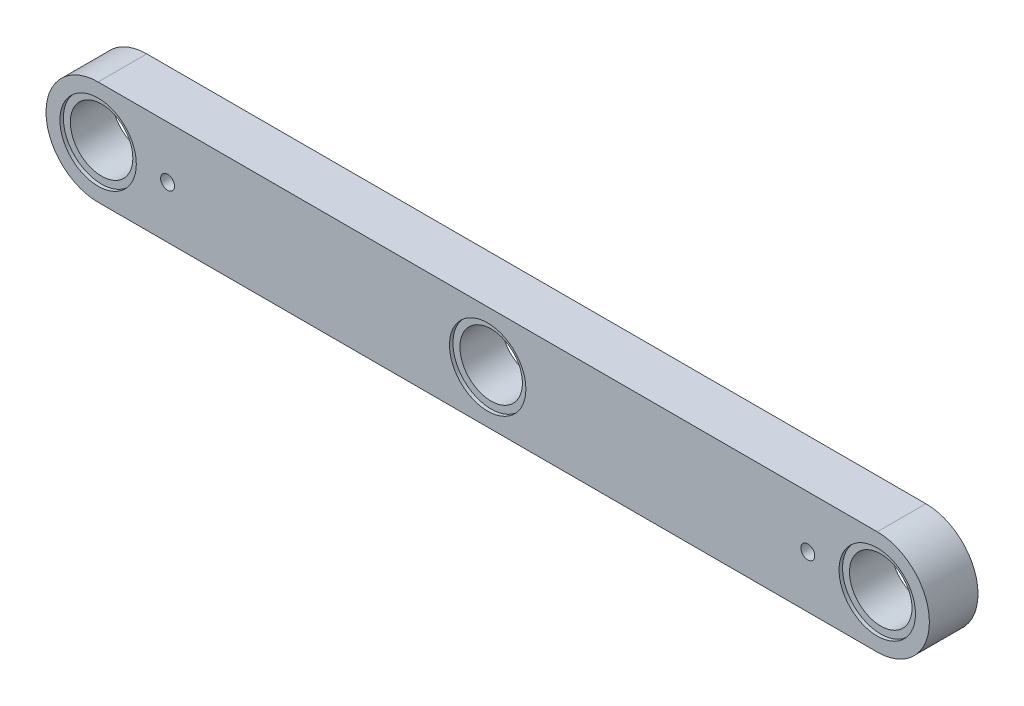
from build123d import *

# Parameters (mm, degrees)
SKETCH1_R           = 11
SKETCH1_R_2         = 2
BOSS_EXTRUDE1_DEPTH = 7
SKETCH3_R           = 11
SKETCH3_R_2         = 9
BOSS_EXTRUDE2_DEPTH = 6


with BuildPart() as part:
    # Sketch1 → Boss-Extrude1 (new, symmetric)
    with BuildSketch(Plane.XY):
        with BuildLine():
            Line((112.155, -15), (-112.155, -15))
            ThreePointArc((-112.155, -15), (-127.155, 0), (-112.155, 15))
            Line((-112.155, 15), (112.155, 15))
            ThreePointArc((112.155, 15), (127.155, 0), (112.155, -15))
        make_face()
        Circle(SKETCH1_R, mode=Mode.SUBTRACT)
        with Locations((112.155, 0)):
            Circle(SKETCH1_R, mode=Mode.SUBTRACT)
        with Locations((-112.155, 0)):
            Circle(SKETCH1_R, mode=Mode.SUBTRACT)
        with Locations((-92.155, 0)):
            Circle(SKETCH1_R_2, mode=Mode.SUBTRACT)
        with Locations((92.155, 0)):
            Circle(SKETCH1_R_2, mode=Mode.SUBTRACT)
    extrude(amount=BOSS_EXTRUDE1_DEPTH, both=True)

    # Sketch3 → Boss-Extrude2 (add, symmetric)
    # profile 1 of 3: a face of its own
    with BuildSketch(Plane.XY):
        with Locations((112.155, 0)):
            Circle(SKETCH3_R)
        with Locations((112.155, 0)):
            Circle(SKETCH3_R_2, mode=Mode.SUBTRACT)
    # profile 2 of 3: a face of its own
    with BuildSketch(Plane.XY):
        Circle(SKETCH3_R)
        Circle(SKETCH3_R_2, mode=Mode.SUBTRACT)
    # profile 3 of 3: a face of its own
    with BuildSketch(Plane.XY):
        with Locations((-112.155, 0)):
            Circle(SKETCH3_R)
        with Locations((-112.155, 0)):
            Circle(SKETCH3_R_2, mode=Mode.SUBTRACT)
    extrude(amount=BOSS_EXTRUDE2_DEPTH, both=True)


solid = part.part
